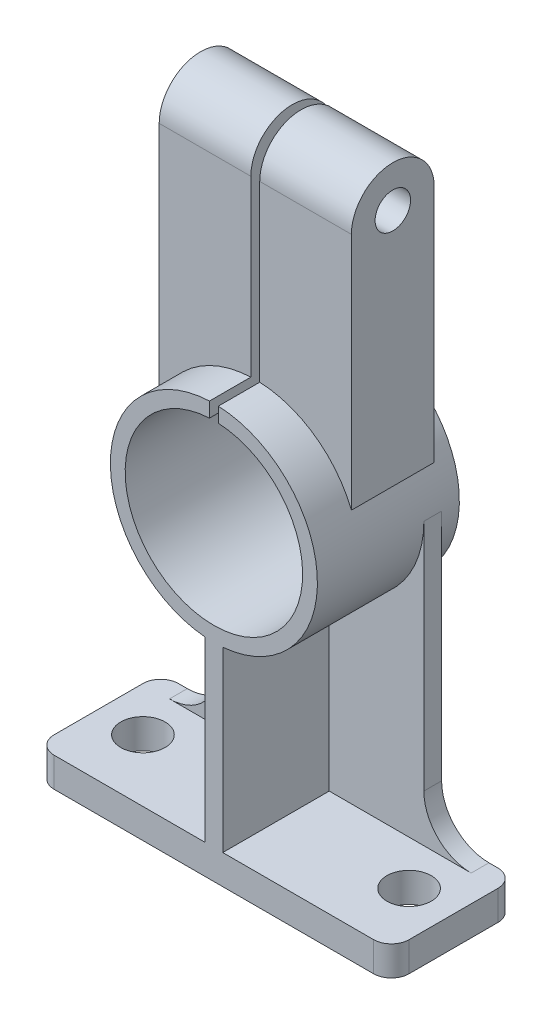
from build123d import *

# Parameters (mm, degrees)
SKETCH1_R            = 7.5
BOSS_EXTRUDE1_DEPTH  = 10
SKETCH2_R            = 35
SKETCH2_R_2          = 30
BOSS_EXTRUDE2_DEPTH  = 48
BOSS_EXTRUDE3_DEPTH  = 6
BOSS_EXTRUDE6_DEPTH  = 3
RIB3_REACH           = 161.7
SKETCH5_WALLS_W      = 6
SKETCH5_WALLS_H      = 381.399436442
FILLET1_R            = 16
SKETCH6_R            = 14
SKETCH6_R_2          = 6
BOSS_EXTRUDE7_DEPTH  = 32.5
BOSS_EXTRUDE8_DEPTH  = 32.5
BOSS_EXTRUDE9_REACH  = 152.18
SKETCH8_W            = 14.472243623
SKETCH8_H            = 28
BOSS_EXTRUDE10_REACH = 152.18
SKETCH9_W            = 14.472243623
SKETCH9_H            = 28
SKETCH10_W           = 3
SKETCH10_H           = 122.594000843
CUT_EXTRUDE1_DEPTH   = 32.5


with BuildPart() as part:
    # Sketch1 → Boss-Extrude1 (new body)
    with BuildSketch(Plane(origin=(0, 0, 0), x_dir=(1, 0, 0), z_dir=(0, 1, 0))):
        with BuildLine():
            Line((-54, 21), (54, 21))
            ThreePointArc((54, 21), (58.242640687, 19.242640687), (60, 15))
            Line((60, 15), (60, -15))
            ThreePointArc((60, -15), (58.242640687, -19.242640687), (54, -21))
            Line((54, -21), (-54, -21))
            ThreePointArc((-54, -21), (-58.242640687, -19.242640687), (-60, -15))
            Line((-60, -15), (-60, 15))
            ThreePointArc((-60, 15), (-58.242640687, 19.242640687), (-54, 21))
        make_face()
        with Locations(Location((-45, 0, 0), (0, 0, 270))):
            Circle(SKETCH1_R, mode=Mode.SUBTRACT)
        with Locations(Location((45, 0, 0), (0, 0, 270))):
            Circle(SKETCH1_R, mode=Mode.SUBTRACT)
    extrude(amount=BOSS_EXTRUDE1_DEPTH)



with BuildPart() as body_2:
    # Sketch2 → Boss-Extrude2 (new body)
    with BuildSketch(Plane.XY.offset(21)):
        with Locations((0, 105)):
            Circle(SKETCH2_R)
        with Locations((0, 105)):
            Circle(SKETCH2_R_2, mode=Mode.SUBTRACT)
    extrude(amount=-BOSS_EXTRUDE2_DEPTH)


with BuildPart() as part_1:
    add(part.part)

    add(body_2.part)  # Boss-Extrude3 merges body 2
    # Sketch3 → Boss-Extrude3 (add)
    with BuildSketch(Plane(origin=(0, 0, -21), x_dir=(-1, 0, 0), z_dir=(0, 0, -1))):
        with BuildLine():
            Line((-35, 10), (35, 10))
            Line((35, 10), (35, 105))
            ThreePointArc((35, 105), (0, 70), (-35, 105))
            Line((-35, 105), (-35, 10))
        make_face()
    extrude(amount=-BOSS_EXTRUDE3_DEPTH)

    # Sketch4 → Boss-Extrude6 (add, symmetric)
    with BuildSketch(Plane(origin=(0, 0, 0), x_dir=(0, 0, -1), z_dir=(1, 0, 0))):
        Polygon((27, 70), (21, 20), (21, 70), (21, 73), (27, 73), align=None)
    extrude(amount=BOSS_EXTRUDE6_DEPTH, both=True)

    # Sketch5 walls → Rib3 (add, up to next)
    with BuildSketch(Plane.XY.offset(21), mode=Mode.PRIVATE) as rib3_sk1:
        with Locations((0, 40)):
            Rectangle(SKETCH5_WALLS_W, SKETCH5_WALLS_H)
    rib3_tool1 = extrude(rib3_sk1.sketch, amount=-RIB3_REACH, mode=Mode.PRIVATE) - part_1.part
    add(rib3_tool1.solids().sort_by_distance((0, 40, 21))[0])

    # Fillet1
    fillet1_edges = [part_1.edges().sort_by_distance(p)[0] for p in [
        (-35, 10, -18),
        (35, 10, -18),
    ]]
    fillet(fillet1_edges, radius=FILLET1_R)



with BuildPart() as body_2_2:
    # Sketch6 → Boss-Extrude7 (new, symmetric)
    with BuildSketch(Plane(origin=(0, 0, 0), x_dir=(0, 0, -1), z_dir=(1, 0, 0))):
        with Locations((7, 198.776584802)):
            Circle(SKETCH6_R)
        with Locations((7, 198.776584802)):
            Circle(SKETCH6_R_2, mode=Mode.SUBTRACT)
    extrude(amount=BOSS_EXTRUDE7_DEPTH, both=True)


with BuildPart() as part_2:
    add(part_1.part)

    add(body_2_2.part)  # Boss-Extrude8 merges body 2 2
    # Sketch7 → Boss-Extrude8 (add, symmetric)
    with BuildSketch(Plane(origin=(0, 0, 0), x_dir=(0, 0, -1), z_dir=(1, 0, 0))):
        with BuildLine():
            Line((21, 198.776584802), (21, 140))
            Line((21, 140), (21, 135))
            Line((21, 135), (-7, 135))
            Line((-7, 135), (-7, 140))
            Line((-7, 140), (-7, 198.776584802))
            ThreePointArc((-7, 198.776584802), (7, 184.776584802), (21, 198.776584802))
        make_face()
    extrude(amount=BOSS_EXTRUDE8_DEPTH, both=True)

    # Sketch8 → Boss-Extrude9 (add, up to next)
    with BuildSketch(Plane.XZ.offset(-135), mode=Mode.PRIVATE) as boss_extrude9_sk1:
        with Locations((25.263878189, -7)):
            Rectangle(SKETCH8_W, SKETCH8_H)
    boss_extrude9_tool1 = extrude(boss_extrude9_sk1.sketch, amount=BOSS_EXTRUDE9_REACH, mode=Mode.PRIVATE) - part_2.part
    add(boss_extrude9_tool1.solids().sort_by_distance((25.263878, 135, -7))[0])

    # Sketch9 → Boss-Extrude10 (add, up to next)
    with BuildSketch(Plane.XZ.offset(-135), mode=Mode.PRIVATE) as boss_extrude10_sk1:
        with Locations((-25.263878189, -7)):
            Rectangle(SKETCH9_W, SKETCH9_H)
    boss_extrude10_tool1 = extrude(boss_extrude10_sk1.sketch, amount=BOSS_EXTRUDE10_REACH, mode=Mode.PRIVATE) - part_2.part
    add(boss_extrude10_tool1.solids().sort_by_distance((-25.263878, 135, -7))[0])

    # Sketch10 → Cut-Extrude1 (cut, symmetric)
    with BuildSketch(Plane.XY):
        with Locations((0, 170.584475275)):
            Rectangle(SKETCH10_W, SKETCH10_H)
    extrude(amount=CUT_EXTRUDE1_DEPTH, both=True, mode=Mode.SUBTRACT)


solid = part_2.part
